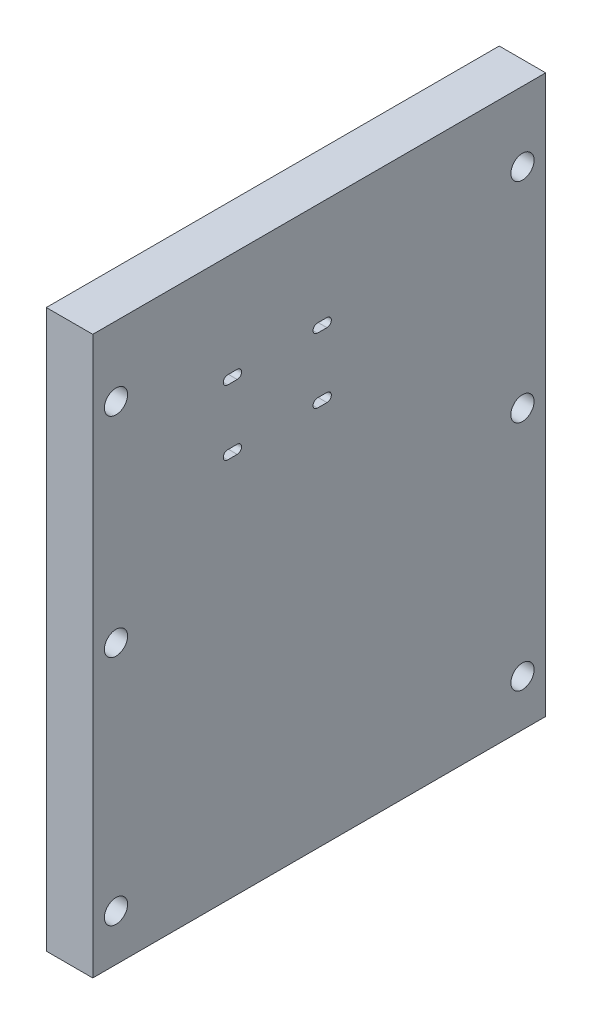
from build123d import *

# Parameters (mm, degrees)
SKETCH1_W           = 123.825
SKETCH1_H           = 152.4
SKETCH1_R           = 3.175
BOSS_EXTRUDE1_DEPTH = 12.7


with BuildPart() as part:
    # Sketch1 → Boss-Extrude1 (new body)
    with BuildSketch(Plane(origin=(0, 0, 0), x_dir=(0, 0, -1), z_dir=(1, 0, 0))):
        with Locations((39.6875, 0)):
            Rectangle(SKETCH1_W, SKETCH1_H)
        with Locations((-15.875, 57.15)):
            Circle(SKETCH1_R, mode=Mode.SUBTRACT)
        with Locations((-15.875, 0)):
            Circle(SKETCH1_R, mode=Mode.SUBTRACT)
        with Locations((95.25, 57.15)):
            Circle(SKETCH1_R, mode=Mode.SUBTRACT)
        with Locations((95.25, 0)):
            Circle(SKETCH1_R, mode=Mode.SUBTRACT)
        with Locations((-15.875, -63.5)):
            Circle(SKETCH1_R, mode=Mode.SUBTRACT)
        with Locations((95.25, -63.5)):
            Circle(SKETCH1_R, mode=Mode.SUBTRACT)
        with BuildLine():
            ThreePointArc((17.261210647, 30.43), (18.461210647, 29.23), (17.261210647, 28.03))
            Line((17.261210647, 28.03), (14.661210647, 28.03))
            ThreePointArc((14.661210647, 28.03), (13.461210647, 29.23), (14.661210647, 30.43))
            Line((14.661210647, 30.43), (17.261210647, 30.43))
        make_face(mode=Mode.SUBTRACT)
        with BuildLine():
            Line((41.801210647, 28.03), (39.201210647, 28.03))
            ThreePointArc((39.201210647, 28.03), (38.001210647, 29.23), (39.201210647, 30.43))
            Line((39.201210647, 30.43), (41.801210647, 30.43))
            ThreePointArc((41.801210647, 30.43), (43.001210647, 29.23), (41.801210647, 28.03))
        make_face(mode=Mode.SUBTRACT)
        with BuildLine():
            ThreePointArc((39.201210647, 45.77), (38.001210647, 46.97), (39.201210647, 48.17))
            Line((39.201210647, 48.17), (41.801210647, 48.17))
            ThreePointArc((41.801210647, 48.17), (43.001210647, 46.97), (41.801210647, 45.77))
            Line((41.801210647, 45.77), (39.201210647, 45.77))
        make_face(mode=Mode.SUBTRACT)
        with BuildLine():
            Line((14.661210647, 48.17), (17.261210647, 48.17))
            ThreePointArc((17.261210647, 48.17), (18.461210647, 46.97), (17.261210647, 45.77))
            Line((17.261210647, 45.77), (14.661210647, 45.77))
            ThreePointArc((14.661210647, 45.77), (13.461210647, 46.97), (14.661210647, 48.17))
        make_face(mode=Mode.SUBTRACT)
    extrude(amount=BOSS_EXTRUDE1_DEPTH)


solid = part.part
